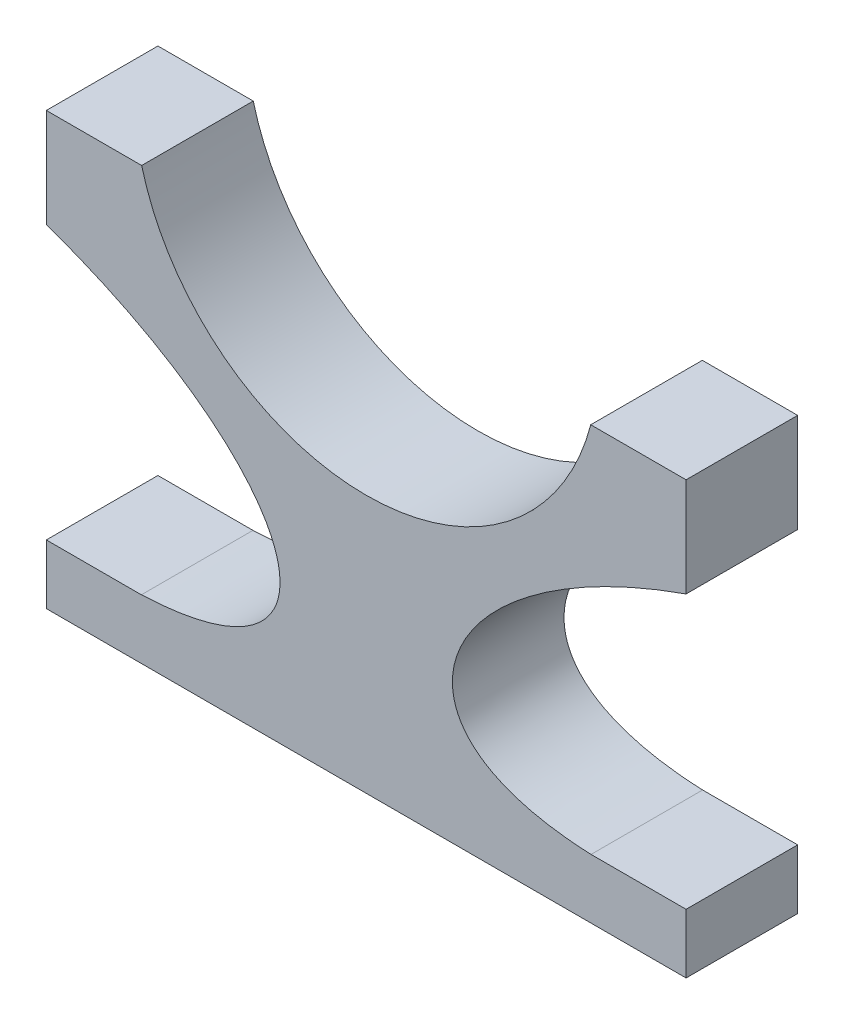
from build123d import *

# Parameters (mm, degrees)
SKETCH_1_W          = 86
SKETCH_1_H          = 58
EXTRUDE_1_DEPTH     = 15
SKETCH_3_R          = 31.2
CUT_EXTRUDE_1_DEPTH = 32
CUT_EXTRUDE_2_DEPTH = 32


with BuildPart() as part:
    # Эскиз1 → Вытянуть1 (new body)
    with BuildSketch(Plane.XY):
        with Locations((43, -29)):
            Rectangle(SKETCH_1_W, SKETCH_1_H)
    extrude(amount=EXTRUDE_1_DEPTH)

    # Эскиз3 → Вырез-Вытянуть1 (cut)
    with BuildSketch(Plane.XY):
        with Locations((43, 7.896260015)):
            Circle(SKETCH_3_R)
    extrude(amount=CUT_EXTRUDE_1_DEPTH, mode=Mode.SUBTRACT)

    # Эскиз6 → Вытянуть2 (cut)
    with BuildSketch(Plane.XY.offset(15)):
        with BuildLine():
            Line((0, -50), (12.775606869, -50))
            add(Edge.make_bspline(
                [(0, -13.292808008), (34.657854921, -25.467090291), (43.133531195, -48.731284944), (12.775606869, -50)],
                knots=[0, 0, 0, 0, 0.936580046, 0.936580046, 0.936580046, 0.936580046], degree=3))
            Line((0, -13.292808008), (-6.736902967, -13.292808008))
            Line((-6.736902967, -13.292808008), (-6.736902967, -50))
            Line((-6.736902967, -50), (0, -50))
        make_face()
        with BuildLine():
            Line((86, -50), (73.224393131, -50))
            add(Edge.make_bspline(
                [(86, -13.292808008), (51.342145079, -25.467090291), (42.866468805, -48.731284944), (73.224393131, -50)],
                knots=[0, 0, 0, 0, 0.936580046, 0.936580046, 0.936580046, 0.936580046], degree=3))
            Line((86, -13.292808008), (92.736902967, -13.292808008))
            Line((92.736902967, -13.292808008), (92.736902967, -50))
            Line((92.736902967, -50), (86, -50))
        make_face()
    extrude(amount=-CUT_EXTRUDE_2_DEPTH, mode=Mode.SUBTRACT)


solid = part.part
